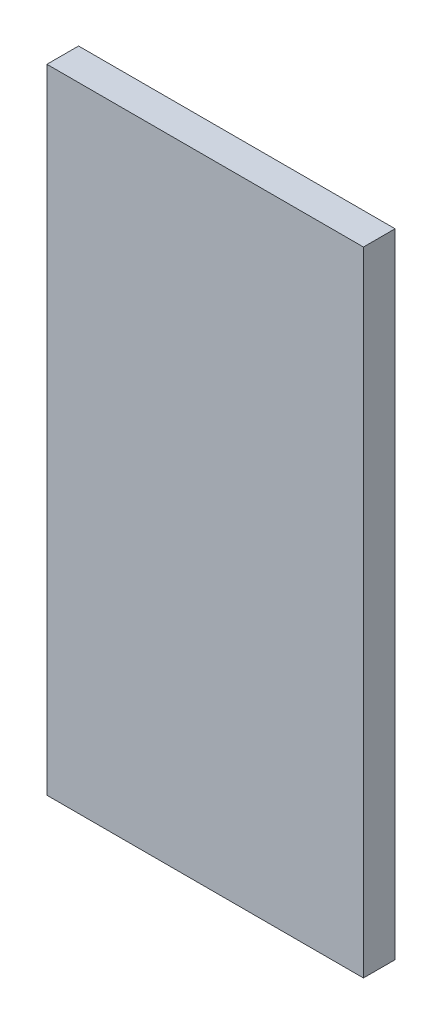
from build123d import *

# Parameters (mm, degrees)
ESQUISSE1_W        = 100
ESQUISSE1_H        = 200
BOSS_EXTRU_1_DEPTH = 10


with BuildPart() as part:
    # Esquisse1 → Boss.-Extru.1 (new body)
    with BuildSketch(Plane.XY):
        Rectangle(ESQUISSE1_W, ESQUISSE1_H)
    extrude(amount=BOSS_EXTRU_1_DEPTH)


solid = part.part
